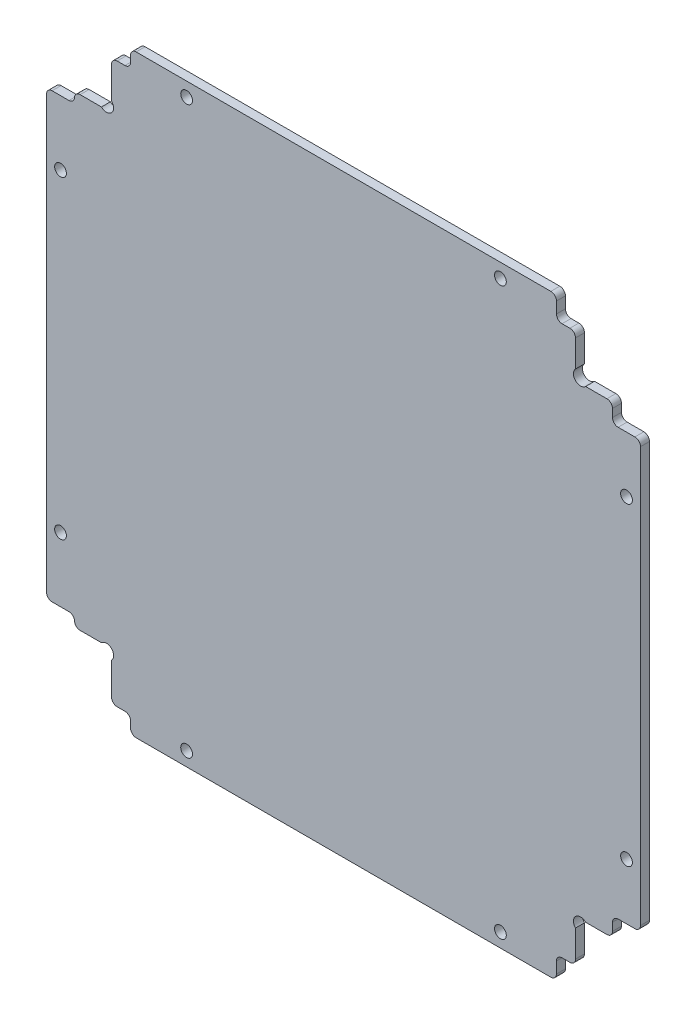
from build123d import *

# Parameters (mm, degrees)
SKETCH1_W            = 106
SKETCH1_H            = 106
MAINOUTLINE_DEPTH    = 1.6
RAILCUTOUTS_DEPTH    = 75.970394157
DOGBONES_DEPTH       = 75.970394157
SOLARFILLETS_DEPTH   = 75.970394157
HANDLINGFILLETS_R    = 1
M2_CLEARANCE_HOLE1_D = 2.1


with BuildPart() as part:
    # Sketch1 → mainOutline (new body)
    with BuildSketch(Plane.XY):
        Rectangle(SKETCH1_W, SKETCH1_H)
    extrude(amount=MAINOUTLINE_DEPTH)

    # Sketch4 → railCutouts (cut, through all)
    with BuildSketch(Plane(origin=(0, 0, 0), x_dir=(-1, 0, 0), z_dir=(0, 0, -1))):
        Polygon((-41.4, -41.4), (-48, -41.4), (-48, -39), (-49.9975, -39), (-60.106513243, -39), (-60.106513243, -61.452099286), (-39, -61.452099286), (-39, -49.9), (-39, -49), (-41.4, -49), align=None)
        Polygon((39, -56.27525328), (39, -49.9), (41.4, -49.9), (41.4, -41.4), (48, -41.4), (48, -40.5), (55.517672261, -40.5), (55.517672261, -56.27525328), align=None)
        Polygon((55.383846757, 40.5), (48, 40.5), (48, 41.4), (41.4, 41.4), (41.4, 49.9), (39, 49.9), (39, 57.687687567), (55.383846757, 57.687687567), align=None)
        Polygon((-39, 59.880423019), (-39, 49.9), (-39, 49), (-41.4, 49), (-41.4, 41.4), (-48, 41.4), (-48, 39), (-49.9975, 39), (-56.842822937, 39), (-56.842822937, 59.880423019), align=None)
    extrude(amount=-RAILCUTOUTS_DEPTH, mode=Mode.SUBTRACT)

    # Sketch5 → dogbones (cut, through all)
    with BuildSketch(Plane(origin=(0, 0, 0), x_dir=(-1, 0, 0), z_dir=(0, 0, -1))):
        with BuildLine():
            Line((-41.4, -43.196051224), (-44.546497129, -46.342548353))
            ThreePointArc((-44.546497129, -46.342548353), (-46.342548353, -46.342548353), (-46.342548353, -44.546497129))
            Line((-46.342548353, -44.546497129), (-43.196051224, -41.4))
            ThreePointArc((-43.196051224, -41.4), (-41.4, -41.4), (-41.4, -43.196051224))
        make_face()
        with BuildLine():
            Line((43.196051224, -41.4), (44.93821772, -43.142166495))
            ThreePointArc((44.93821772, -43.142166495), (44.93821772, -44.93821772), (43.142166495, -44.93821772))
            Line((43.142166495, -44.93821772), (41.4, -43.196051224))
            ThreePointArc((41.4, -43.196051224), (41.4, -41.4), (43.196051224, -41.4))
        make_face()
        with BuildLine():
            Line((41.4, 43.196051224), (43.13099025, 44.927041474))
            ThreePointArc((43.13099025, 44.927041474), (44.927041474, 44.927041474), (44.927041474, 43.13099025))
            Line((44.927041474, 43.13099025), (43.196051224, 41.4))
            ThreePointArc((43.196051224, 41.4), (41.4, 41.4), (41.4, 43.196051224))
        make_face()
        with BuildLine():
            Line((-43.196051224, 41.4), (-44.694846249, 42.898795025))
            ThreePointArc((-44.694846249, 42.898795025), (-44.694846249, 44.694846249), (-42.898795025, 44.694846249))
            Line((-42.898795025, 44.694846249), (-41.4, 43.196051224))
            ThreePointArc((-41.4, 43.196051224), (-41.4, 41.4), (-43.196051224, 41.4))
        make_face()
    extrude(amount=-DOGBONES_DEPTH, mode=Mode.SUBTRACT)

    # Sketch6 → solarFillets (cut, through all)
    with BuildSketch(Plane(origin=(0, 0, 0), x_dir=(-1, 0, 0), z_dir=(0, 0, -1))):
        with BuildLine():
            Line((-40, 50), (-40, 53))
            ThreePointArc((-40, 53), (-39, 54), (-38, 53))
            Line((-38, 53), (-38, 50))
            ThreePointArc((-38, 50), (-39, 49), (-40, 50))
        make_face()
        with BuildLine():
            Line((-49, 38), (-53, 38))
            ThreePointArc((-53, 38), (-54, 39), (-53, 40))
            Line((-53, 40), (-49, 40))
            ThreePointArc((-49, 40), (-48, 39), (-49, 38))
        make_face()
        with BuildLine():
            Line((-49, -40), (-55.214202913, -40))
            ThreePointArc((-55.214202913, -40), (-56.214202913, -39), (-55.214202913, -38))
            Line((-55.214202913, -38), (-49, -38))
            ThreePointArc((-49, -38), (-48, -39), (-49, -40))
        make_face()
        with BuildLine():
            Line((-38, -50), (-38, -53.916094318))
            ThreePointArc((-38, -53.916094318), (-39, -54.916094318), (-40, -53.916094318))
            Line((-40, -53.916094318), (-40, -50))
            ThreePointArc((-40, -50), (-39, -49), (-38, -50))
        make_face()
        with BuildLine():
            Line((40, -50.9), (40, -54.538013421))
            ThreePointArc((40, -54.538013421), (39, -55.538013421), (38, -54.538013421))
            Line((38, -54.538013421), (38, -50.9))
            ThreePointArc((38, -50.9), (39, -49.9), (40, -50.9))
        make_face()
        with BuildLine():
            Line((49, -39.5), (54.202622605, -39.5))
            ThreePointArc((54.202622605, -39.5), (55.202622605, -40.5), (54.202622605, -41.5))
            Line((54.202622605, -41.5), (49, -41.5))
            ThreePointArc((49, -41.5), (48, -40.5), (49, -39.5))
        make_face()
        with BuildLine():
            Line((49, 41.5), (54.556563772, 41.5))
            ThreePointArc((54.556563772, 41.5), (55.556563772, 40.5), (54.556563772, 39.5))
            Line((54.556563772, 39.5), (49, 39.5))
            ThreePointArc((49, 39.5), (48, 40.5), (49, 41.5))
        make_face()
        with BuildLine():
            Line((38, 50.9), (38, 55.828092709))
            ThreePointArc((38, 55.828092709), (39, 56.828092709), (40, 55.828092709))
            Line((40, 55.828092709), (40, 50.9))
            ThreePointArc((40, 50.9), (39, 49.9), (38, 50.9))
        make_face()
    extrude(amount=-SOLARFILLETS_DEPTH, mode=Mode.SUBTRACT)

    # handlingFillets
    handlingfillets_edges = [part.edges().sort_by_distance(p)[0] for p in [
        (-41.4, -49.9, 0.8),
        (-38, -53, 0.8),
        (-53, -39.5, 0.8),
        (-48, -41.4, 0.8),
        (-48, 41.4, 0.8),
        (-53, 39.5, 0.8),
        (-41.4, 49.9, 0.8),
        (-38, 53, 0.8),
        (38, 53, 0.8),
        (41.4, 49, 0.8),
        (48, 41.4, 0.8),
        (53, 38, 0.8),
        (53, -38, 0.8),
        (48, -41.4, 0.8),
        (41.4, -49, 0.8),
        (38, -53, 0.8),
    ]]
    fillet(handlingfillets_edges, radius=HANDLINGFILLETS_R)

    # M2 Clearance Hole1 (through all)
    with Locations(Plane(origin=(0, 0, 0), x_dir=(-1, 0, 0), z_dir=(0, 0, -1))):
        with Locations((50.5, -28), (28, -50.5), (-50.5, -28), (-28, -50.5), (-28, 50.5), (-50.5, 28), (28, 50.5), (50.5, 28)):
            Hole(M2_CLEARANCE_HOLE1_D / 2)


solid = part.part
